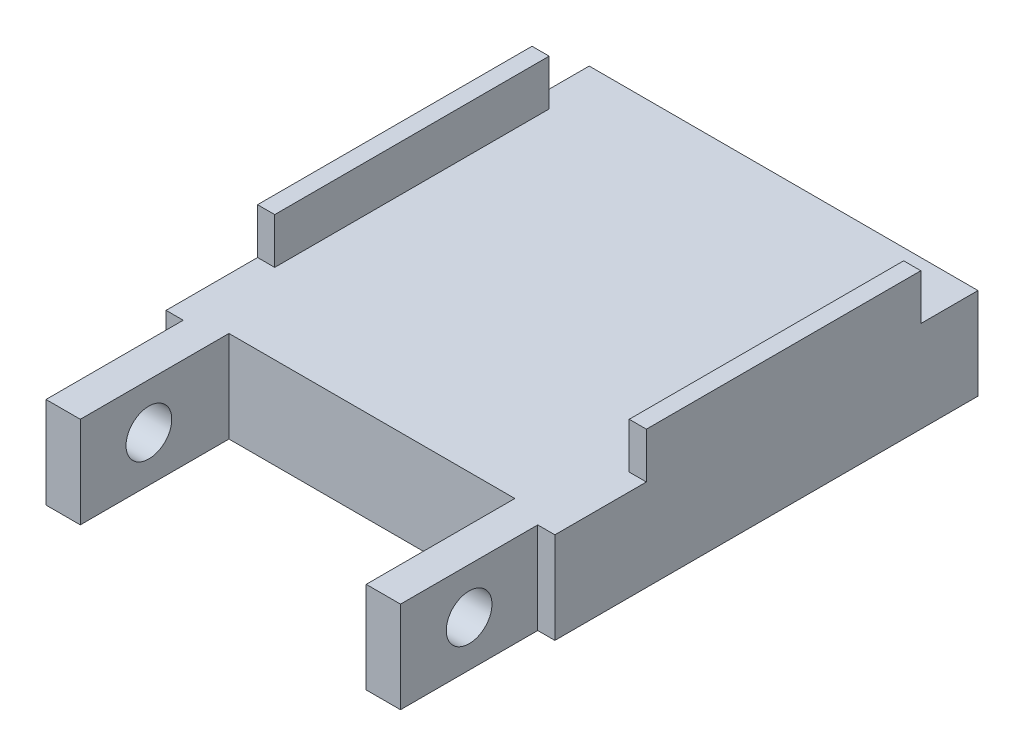
from build123d import *

# Parameters (mm, degrees)
SKETCH_1_W          = 34
SKETCH_1_H          = 49
EXTRUDE_1_DEPTH     = 8
SKETCH_2_W          = 1.5
SKETCH_2_H          = 24
EXTRUDE_2_DEPTH     = 4
SKETCH_3_W          = 1.5
SKETCH_3_H          = 12
SKETCH_3_W_2        = 25
SKETCH_3_H_2        = 13
CUT_EXTRUDE_1_DEPTH = 8
CUT_EXTRUDE_2_REACH = 44.432
SKETCH_4_R          = 2
EXTRUDE_3_DEPTH     = 8
SKETCH_6_R          = 1.5
SKETCH_6_R_2        = 0.5
CUT_EXTRUDE_3_DEPTH = 5
CUT_EXTRUDE_4_DEPTH = 8


with BuildPart() as part:
    # 草图1 → 凸台-拉伸1 (new body)
    with BuildSketch(Plane(origin=(0, 0, 0), x_dir=(1, 0, 0), z_dir=(0, 1, 0))):
        Rectangle(SKETCH_1_W, SKETCH_1_H)
    extrude(amount=EXTRUDE_1_DEPTH)

    # 草图2 → 凸台-拉伸2 (add)
    with BuildSketch(Plane(origin=(0, 8, 0), x_dir=(1, 0, 0), z_dir=(0, 1, 0))):
        with Locations((-16.25, 7.5)):
            Rectangle(SKETCH_2_W, SKETCH_2_H)
        with Locations((16.25, 7.5)):
            Rectangle(SKETCH_2_W, SKETCH_2_H)
    extrude(amount=EXTRUDE_2_DEPTH)

    # 草图3 → 切除-拉伸1 (cut)
    with BuildSketch(Plane(origin=(0, 8, 0), x_dir=(1, 0, 0), z_dir=(0, 1, 0))):
        with Locations((-16.25, -18.5)):
            Rectangle(SKETCH_3_W, SKETCH_3_H)
        with Locations((16.25, -18.5)):
            Rectangle(SKETCH_3_W, SKETCH_3_H)
        with Locations((0, -18)):
            Rectangle(SKETCH_3_W_2, SKETCH_3_H_2)
    extrude(amount=-CUT_EXTRUDE_1_DEPTH, mode=Mode.SUBTRACT)

    # 切除-拉伸2: up to this face of the body (flat: up to its plane)
    cut_extrude_2_end = Plane(part.part.faces().sort_by_distance((15.5, 4, 18.5))[0])
    # 草图4 → 切除-拉伸2 (cut, up to the picked face)
    with BuildSketch(Plane.ZY.offset(15.5), mode=Mode.PRIVATE) as cut_extrude_2_sk1:
        with Locations((18.5, 4)):
            Circle(SKETCH_4_R)
    cut_extrude_2_tool1 = split(extrude(cut_extrude_2_sk1.sketch, amount=-CUT_EXTRUDE_2_REACH, mode=Mode.PRIVATE), bisect_by=cut_extrude_2_end, keep=Keep.BOTH, mode=Mode.PRIVATE)
    add(cut_extrude_2_tool1.solids().sort_by(Axis((-15.5, 4, 18.5), (1, 0, 0)))[0], mode=Mode.SUBTRACT)

    # 草图5 → 凸台-拉伸3 (add)
    with BuildSketch(Plane.XZ):
        Polygon((4, 11.5), (-4, 11.5), (-4, 41.5), (-13, 41.5), (-13, 56.5), (13, 56.5), (13, 41.5), (4, 41.5), align=None)
    extrude(amount=-EXTRUDE_3_DEPTH)

    # 草图6 → 切除-拉伸3 (cut)
    with BuildSketch(Plane.XZ):
        with Locations(Location((0, -9.5, 0), (0, 0, 270))):
            Circle(SKETCH_6_R)
        with Locations(Location((5, -9.5, 0), (0, 0, 270))):
            Circle(SKETCH_6_R_2)
        with Locations(Location((11, -9.5, 0), (0, 0, 270))):
            Circle(SKETCH_6_R_2)
        with Locations(Location((-4.5, -9.5, 0), (0, 0, 270))):
            Circle(SKETCH_6_R_2)
        with Locations(Location((-10.5, -9.5, 0), (0, 0, 270))):
            Circle(SKETCH_6_R_2)
        with Locations(Location((0, -14, 0), (0, 0, 270))):
            Circle(SKETCH_6_R_2)
        with Locations(Location((0, -5, 0), (0, 0, 270))):
            Circle(SKETCH_6_R_2)
    extrude(amount=-CUT_EXTRUDE_3_DEPTH, mode=Mode.SUBTRACT)

    # 草图5<2> → 切除-拉伸4 (cut)
    with BuildSketch(Plane.XZ):
        Polygon((4, 11.5), (-4, 11.5), (-4, 41.5), (-13, 41.5), (-13, 56.5), (13, 56.5), (13, 41.5), (4, 41.5), align=None)
    extrude(amount=-CUT_EXTRUDE_4_DEPTH, mode=Mode.SUBTRACT)


solid = part.part
